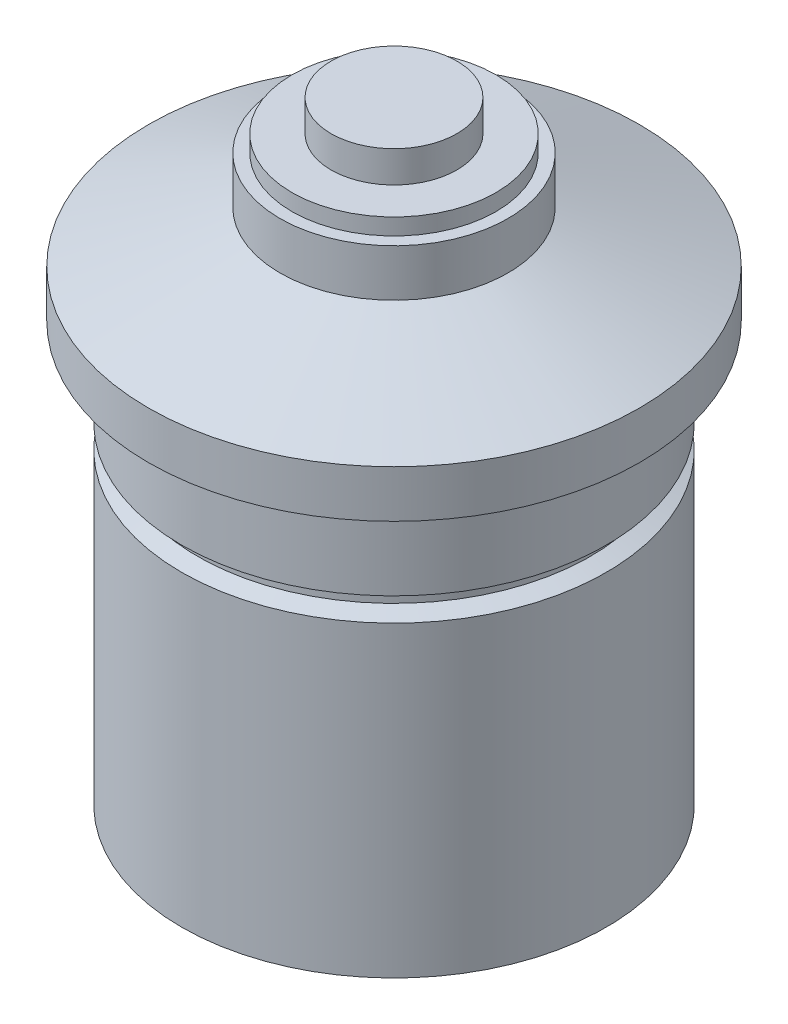
from build123d import *

# Parameters (mm, degrees)
FILLET1_R = 0.508


with BuildPart() as part:
    # Sketch1 → Revolve1 (revolve)
    with BuildSketch(Plane.XY):
        Polygon((4, 40.748), (4, 42.748), (0, 42.748), (0, 0), (7.71, 0), (7.71, 2.8), (9, 2.8), (9, 3.8), (13.5, 3.8), (13.5, 30.440205684), (15.6125, 30.440205684), (15.6125, 33.447007876), (7.25, 36.7), (7.25, 39.7), (6.488, 39.7), (6.488, 40.748), align=None)
    revolve(axis=Axis((0, 42.748, 0), (0, -1, 0)))

    # Sketch2 → Cut-Revolve1 (revolve, cut)
    with BuildSketch(Plane.XY):
        with BuildLine():
            Line((-13.5, 24.840205684), (-12.484, 24.471205684))
            Line((-12.484, 24.471205684), (-12.484, 23.709205684))
            Line((-12.484, 23.709205684), (-13.5, 23.340205684))
            ThreePointArc((-13.5, 23.340205684), (-14.429321734, 24.090205684), (-13.5, 24.840205684))
        make_face()
    revolve(axis=Axis((0, 0, 0), (0, 1, 0)), mode=Mode.SUBTRACT)

    # Fillet1
    fillet1_edges = [part.edges().sort_by_distance(p)[0] for p in [
        (-9, 2.8, 0),
    ]]
    fillet(fillet1_edges, radius=FILLET1_R)


solid = part.part
